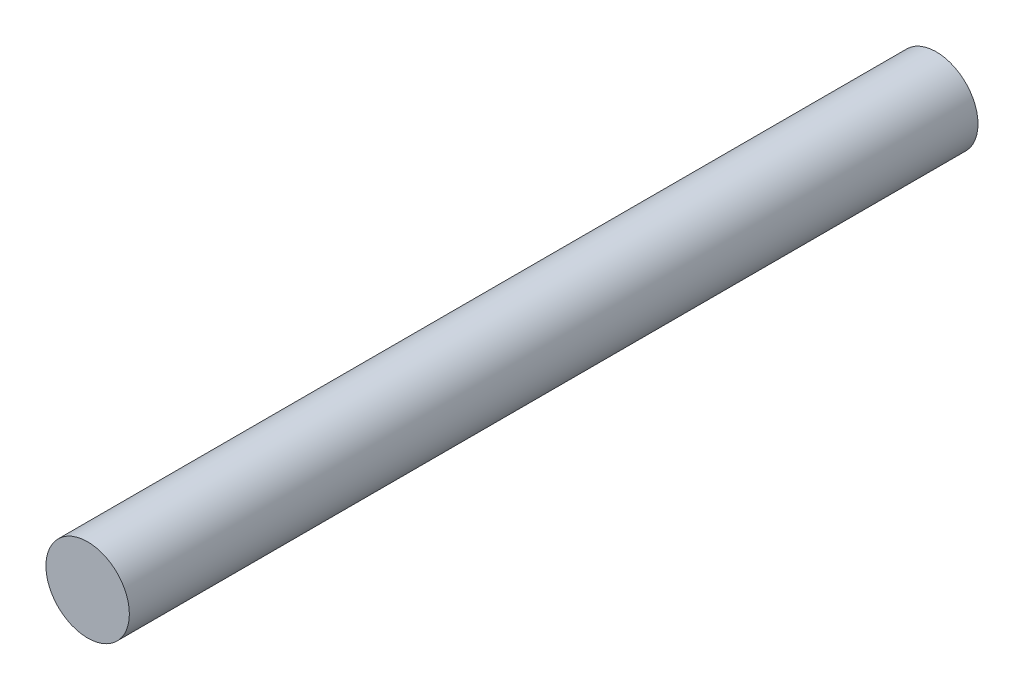
from build123d import *

# Parameters (mm, degrees)
SKETCH1_R           = 4.7625
BOSS_EXTRUDE1_DEPTH = 96.8756


with BuildPart() as part:
    # Sketch1 → Boss-Extrude1 (new body)
    with BuildSketch(Plane.XY):
        Circle(SKETCH1_R)
    extrude(amount=BOSS_EXTRUDE1_DEPTH)


solid = part.part
